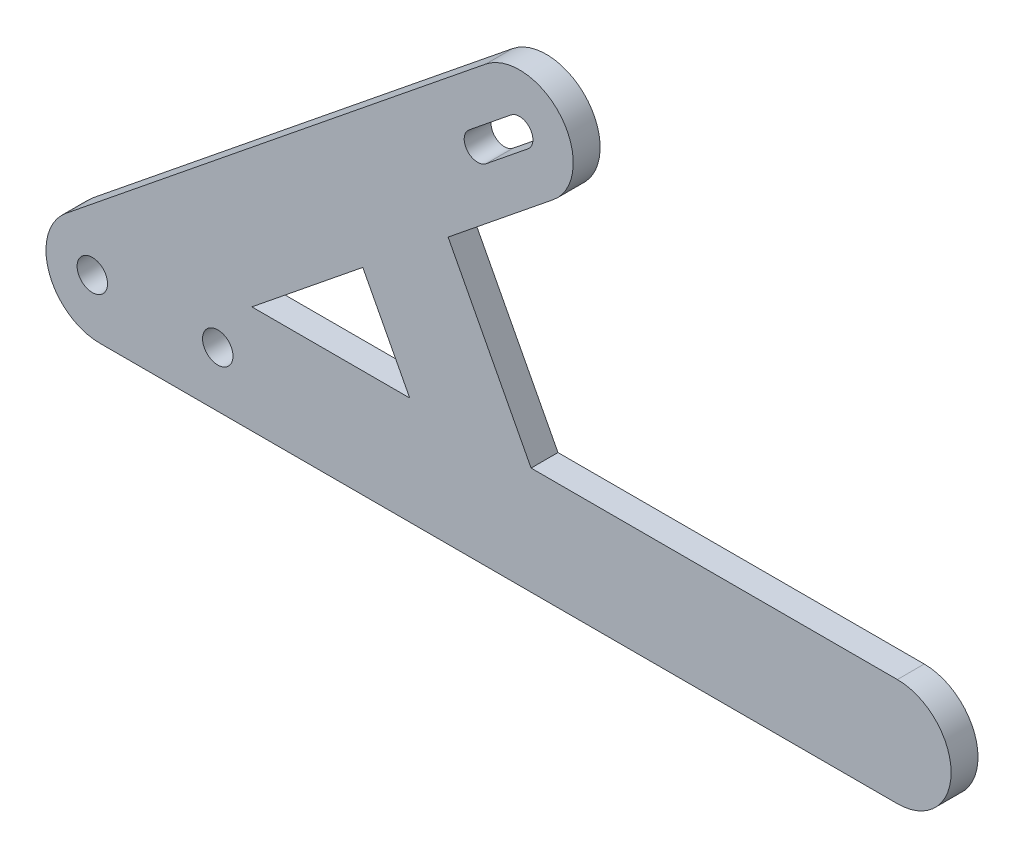
from build123d import *

# Parameters (mm, degrees)
BOSS_EXTRU_1_DEPTH   = 3
D_GAGEMENT_M31_D     = 3.4
D_GAGEMENT_M31_DEPTH = 10
D_GAGEMENT_M31_TIP   = 1.021463052


with BuildPart() as part:
    # Esquisse1 → Boss.-Extru.1 (new body)
    with BuildSketch(Plane.XY):
        with BuildLine():
            Line((-5.626876244, 23.692571189), (6.10421614, 33.170262072))
            ThreePointArc((6.10421614, 33.170262072), (7.000718602, 41.608051079), (-1.437070405, 42.504553542))
            Line((-1.437070405, 42.504553542), (-48.270643273, 4.667145735))
            ThreePointArc((-48.270643273, 4.667145735), (-50.15698128, -1.999640667), (-44.5, -6))
            Line((-44.5, -6), (44.5, -6))
            ThreePointArc((44.5, -6), (50.5, 0), (44.5, 6))
            Line((44.5, 6), (3.632012331, 6))
            Line((3.632012331, 6), (-5.626876244, 23.692571189))
        make_face()
        Polygon((-9.91186062, 6), (-15.146064211, 16.001904537), (-27.526006497, 6), align=None, mode=Mode.SUBTRACT)
        with BuildLine():
            ThreePointArc((-3.276233686, 35.233550968), (-3.500359301, 33.124103716), (-1.390912049, 32.8999781))
            Line((-1.390912049, 32.8999781), (3.276233686, 36.670621373))
            ThreePointArc((3.276233686, 36.670621373), (3.500359301, 38.780068625), (1.390912049, 39.00419424))
            Line((1.390912049, 39.00419424), (-3.276233686, 35.233550968))
        make_face(mode=Mode.SUBTRACT)
    extrude(amount=BOSS_EXTRU_1_DEPTH)

    # Dégagement M31
    with Locations(Plane.XY.offset(3)):
        with Locations((-45.329154162, 0.177691477), (-31.329154162, 0.177691477)):
            Hole(D_GAGEMENT_M31_D / 2, depth=D_GAGEMENT_M31_DEPTH)
            with Locations((0, 0, -(D_GAGEMENT_M31_DEPTH + D_GAGEMENT_M31_TIP / 2))):  # 118° drill point
                Cone(0, D_GAGEMENT_M31_D / 2, D_GAGEMENT_M31_TIP, mode=Mode.SUBTRACT)


solid = part.part
